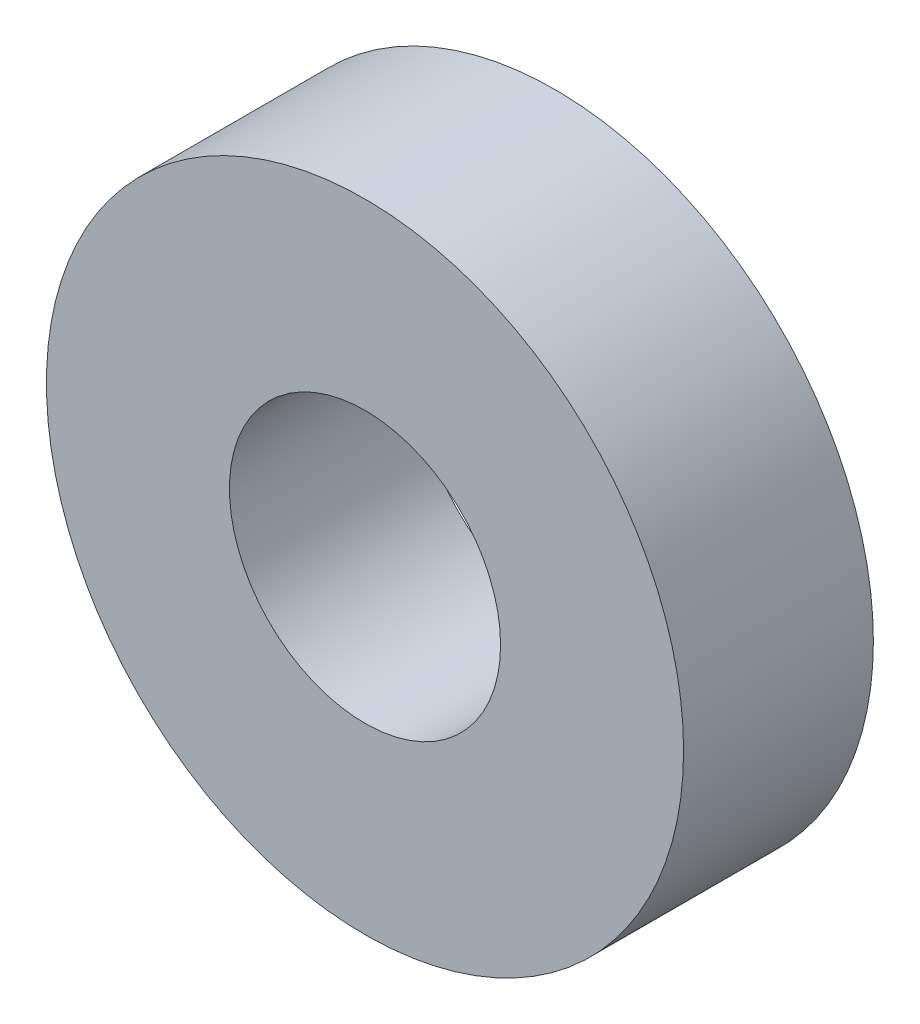
from build123d import *

# Parameters (mm, degrees)
PURCHASED_BEARING_ENVELOPE_START = 31
SKETCH_1_R                       = 23.5
SKETCH_1_R_2                     = 10
PURCHASED_BEARING_ENVELOPE_DEPTH = 14


with BuildPart() as part:
    # Эскиз1 → Purchased_bearing_envelope (new body)
    with BuildSketch(Plane.XY.offset(PURCHASED_BEARING_ENVELOPE_START)):
        Circle(SKETCH_1_R)
        Circle(SKETCH_1_R_2, mode=Mode.SUBTRACT)
    extrude(amount=PURCHASED_BEARING_ENVELOPE_DEPTH)


solid = part.part
